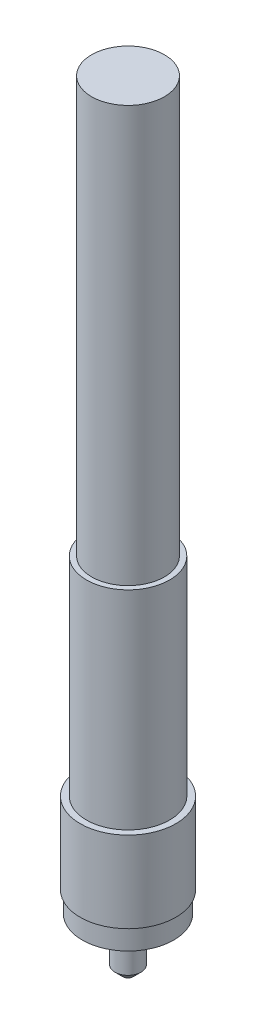
from build123d import *

# Parameters (mm, degrees)
SKETCH_1_R          = 4.6
EXTRUDE_1_DEPTH     = 9.8
SKETCH_2_R          = 4.6
SKETCH_2_R_2        = 4.4
CUT_EXTRUDE_1_DEPTH = 2
SKETCH_3_R          = 3.9
SKETCH_3_R_2        = 2.9
CUT_EXTRUDE_2_DEPTH = 4
SKETCH_4_R          = 2.4
CUT_EXTRUDE_3_DEPTH = 5
SKETCH_5_R          = 1.25
EXTRUDE_4_DEPTH     = 10
CHAMFER_1_SIZE      = 0.75
EXTRUDE_START       = 1
SKETCH_6_R          = 2.9
SKETCH_6_R_2        = 2.4
EXTRUDE_5_DEPTH     = 1
SKETCH_7_R          = 4
EXTRUDE_6_DEPTH     = 20
SKETCH_8_R          = 3.5
EXTRUDE_7_DEPTH     = 40


with BuildPart() as part:
    # 草图1 → 拉伸1 (new body)
    with BuildSketch(Plane(origin=(0, 0, 0), x_dir=(1, 0, 0), z_dir=(0, 1, 0))):
        with Locations(Location((0, 0, 0), (0, 0, 270))):
            Circle(SKETCH_1_R)
    extrude(amount=EXTRUDE_1_DEPTH)

    # 草图2 → 切除-拉伸1 (cut)
    with BuildSketch(Plane.XZ):
        with Locations(Location((0, 0, 0), (0, 0, 270))):
            Circle(SKETCH_2_R)
        with Locations(Location((0, 0, 0), (0, 0, 270))):
            Circle(SKETCH_2_R_2, mode=Mode.SUBTRACT)
    extrude(amount=-CUT_EXTRUDE_1_DEPTH, mode=Mode.SUBTRACT)

    # 草图3 → 切除-拉伸2 (cut)
    with BuildSketch(Plane.XZ):
        with Locations(Location((0, 0, 0), (0, 0, 270))):
            Circle(SKETCH_3_R)
        with Locations(Location((0, 0, 0), (0, 0, 270))):
            Circle(SKETCH_3_R_2, mode=Mode.SUBTRACT)
    extrude(amount=-CUT_EXTRUDE_2_DEPTH, mode=Mode.SUBTRACT)

    # 草图4 → 切除-拉伸3 (cut)
    with BuildSketch(Plane.XZ):
        with Locations(Location((0, 0, 0), (0, 0, 270))):
            Circle(SKETCH_4_R)
    extrude(amount=-CUT_EXTRUDE_3_DEPTH, mode=Mode.SUBTRACT)

    # 草图5 → 拉伸4 (add)
    with BuildSketch(Plane.XZ.offset(-5)):
        with Locations(Location((0, 0, 0), (0, 0, 270))):
            Circle(SKETCH_5_R)
    extrude(amount=EXTRUDE_4_DEPTH)

    # 倒角1
    chamfer_1_edges = [part.edges().sort_by_distance(p)[0] for p in [
        (0, -5, 1.25),
    ]]
    chamfer(chamfer_1_edges, length=CHAMFER_1_SIZE)

    # 草图6 → 拉伸5 (add)
    with BuildSketch(Plane.XZ.offset(EXTRUDE_START)):
        with Locations(Location((0, 0, 0), (0, 0, 270))):
            Circle(SKETCH_6_R)
        with Locations(Location((0, 0, 0), (0, 0, 270))):
            Circle(SKETCH_6_R_2, mode=Mode.SUBTRACT)
    extrude(amount=-EXTRUDE_5_DEPTH)

    # 草图7 → 拉伸6 (add)
    with BuildSketch(Plane(origin=(0, 9.8, 0), x_dir=(-1, 0, 0), z_dir=(0, 1, 0))):
        with Locations(Location((0, 0, 0), (0, 0, 90))):
            Circle(SKETCH_7_R)
    extrude(amount=EXTRUDE_6_DEPTH)

    # 草图8 → 拉伸7 (add)
    with BuildSketch(Plane(origin=(0, 29.8, 0), x_dir=(-1, 0, 0), z_dir=(0, 1, 0))):
        with Locations(Location((0, 0, 0), (0, 0, 90))):
            Circle(SKETCH_8_R)
    extrude(amount=EXTRUDE_7_DEPTH)


solid = part.part
